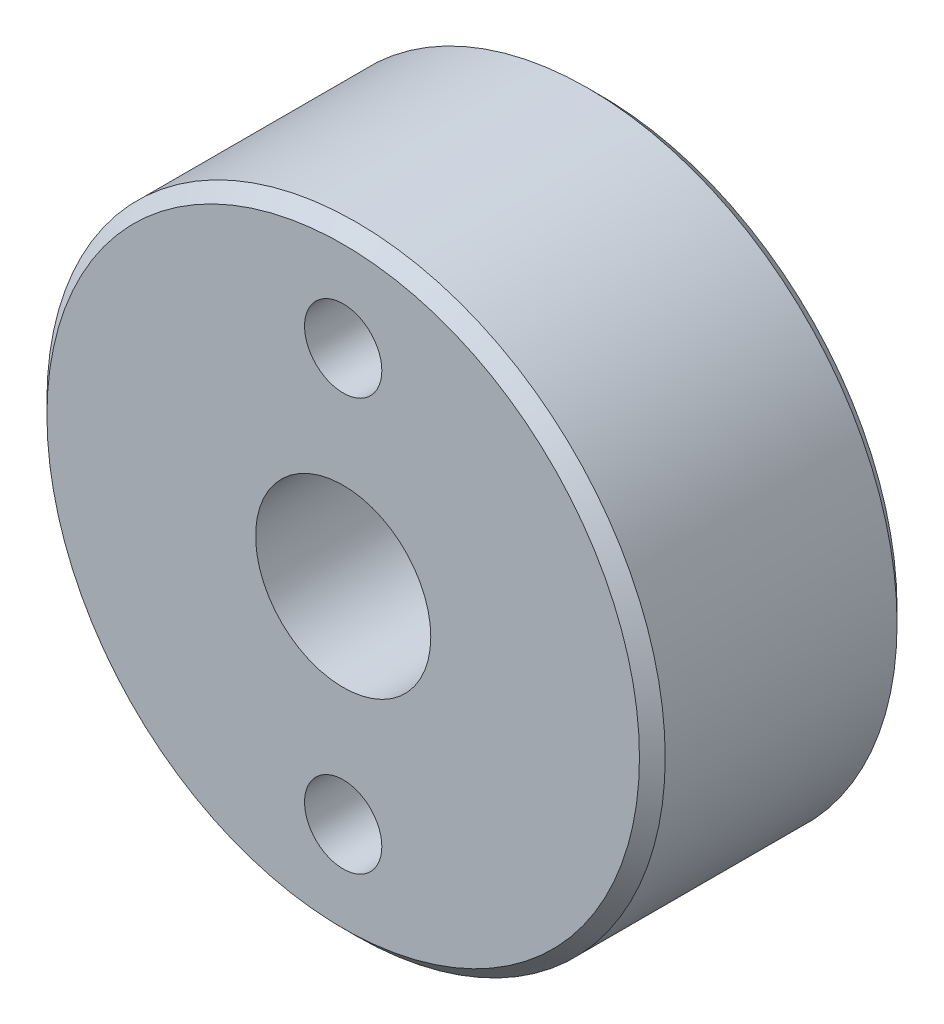
from build123d import *

# Parameters (mm, degrees)
SKETCH_1_R             = 12
EXTRUDE_1_DEPTH        = 10
CHAMFER_1_SIZE         = 0.5
HOLE_WIZARD_M8_1_D     = 6.8
HOLE_WIZARD_M8_1_DEPTH = 17.707073895
HOLE_WIZARD_M8_1_TIP   = 2.042926105
F_3_0MM_1_D            = 3
F_3_0MM_1_DEPTH        = 18.848709071
F_3_0MM_1_TIP          = 0.901290929


with BuildPart() as part:
    # 草图1 → 凸台-拉伸1 (new body)
    with BuildSketch(Plane.XY):
        Circle(SKETCH_1_R)
    extrude(amount=EXTRUDE_1_DEPTH)

    # 倒角1
    chamfer_1_edges = [part.edges().sort_by_distance(p)[0] for p in [
        (-12, 0, 0),
        (-12, 0, 10),
    ]]
    chamfer(chamfer_1_edges, length=CHAMFER_1_SIZE)

    # M8 螺纹孔1
    with Locations(Plane.XY.offset(10)):
        with Locations((0, 0)):
            Hole(HOLE_WIZARD_M8_1_D / 2, depth=HOLE_WIZARD_M8_1_DEPTH)
            with Locations((0, 0, -(HOLE_WIZARD_M8_1_DEPTH + HOLE_WIZARD_M8_1_TIP / 2))):  # 118° drill point
                Cone(0, HOLE_WIZARD_M8_1_D / 2, HOLE_WIZARD_M8_1_TIP, mode=Mode.SUBTRACT)

    # Ø3.0mm 暗销孔1
    with Locations(Plane.XY.offset(10)):
        with Locations((0, -8), (0, 8)):
            Hole(F_3_0MM_1_D / 2, depth=F_3_0MM_1_DEPTH)
            with Locations((0, 0, -(F_3_0MM_1_DEPTH + F_3_0MM_1_TIP / 2))):  # 118° drill point
                Cone(0, F_3_0MM_1_D / 2, F_3_0MM_1_TIP, mode=Mode.SUBTRACT)


solid = part.part
